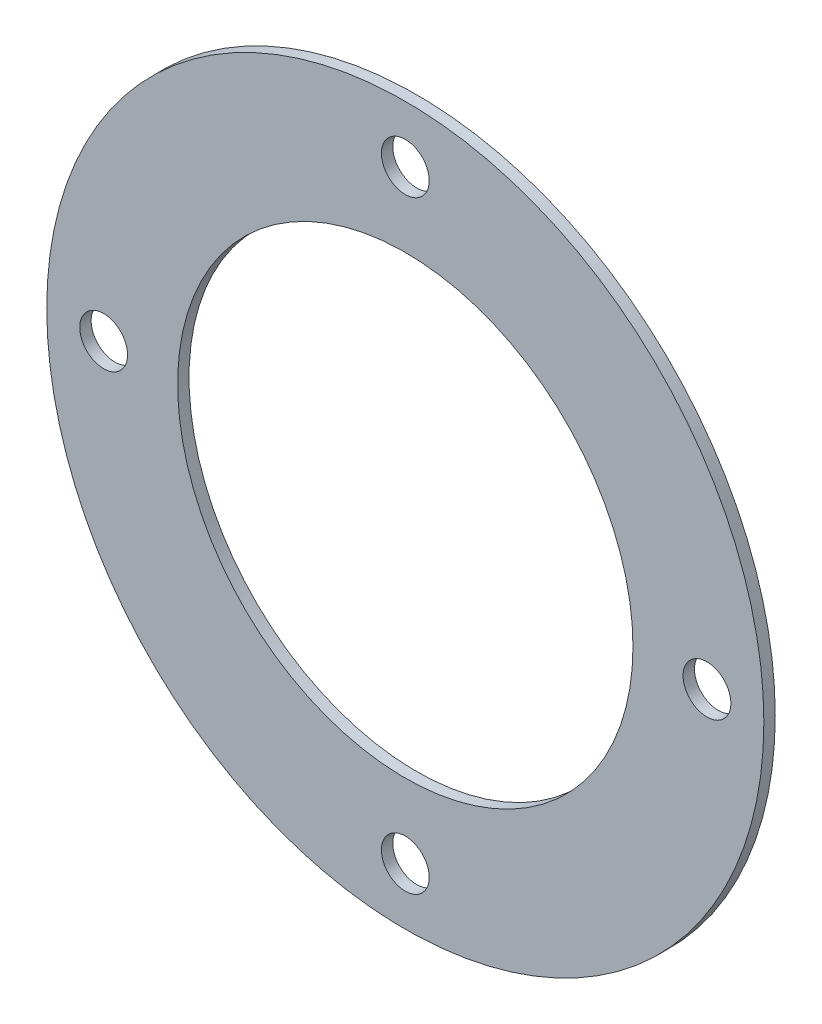
from build123d import *

# Parameters (mm, degrees)
SKETCH_1_R      = 31.5
SKETCH_1_R_2    = 20
SKETCH_1_R_3    = 2.1
EXTRUDE_1_DEPTH = 1


with BuildPart() as part:
    # 草图1 → 凸台-拉伸1 (new body)
    with BuildSketch(Plane.XY):
        Circle(SKETCH_1_R)
        Circle(SKETCH_1_R_2, mode=Mode.SUBTRACT)
        with Locations((0, 26.5)):
            Circle(SKETCH_1_R_3, mode=Mode.SUBTRACT)
        with Locations((26.5, 0)):
            Circle(SKETCH_1_R_3, mode=Mode.SUBTRACT)
        with Locations((0, -26.5)):
            Circle(SKETCH_1_R_3, mode=Mode.SUBTRACT)
        with Locations((-26.5, 0)):
            Circle(SKETCH_1_R_3, mode=Mode.SUBTRACT)
    extrude(amount=EXTRUDE_1_DEPTH)


solid = part.part
